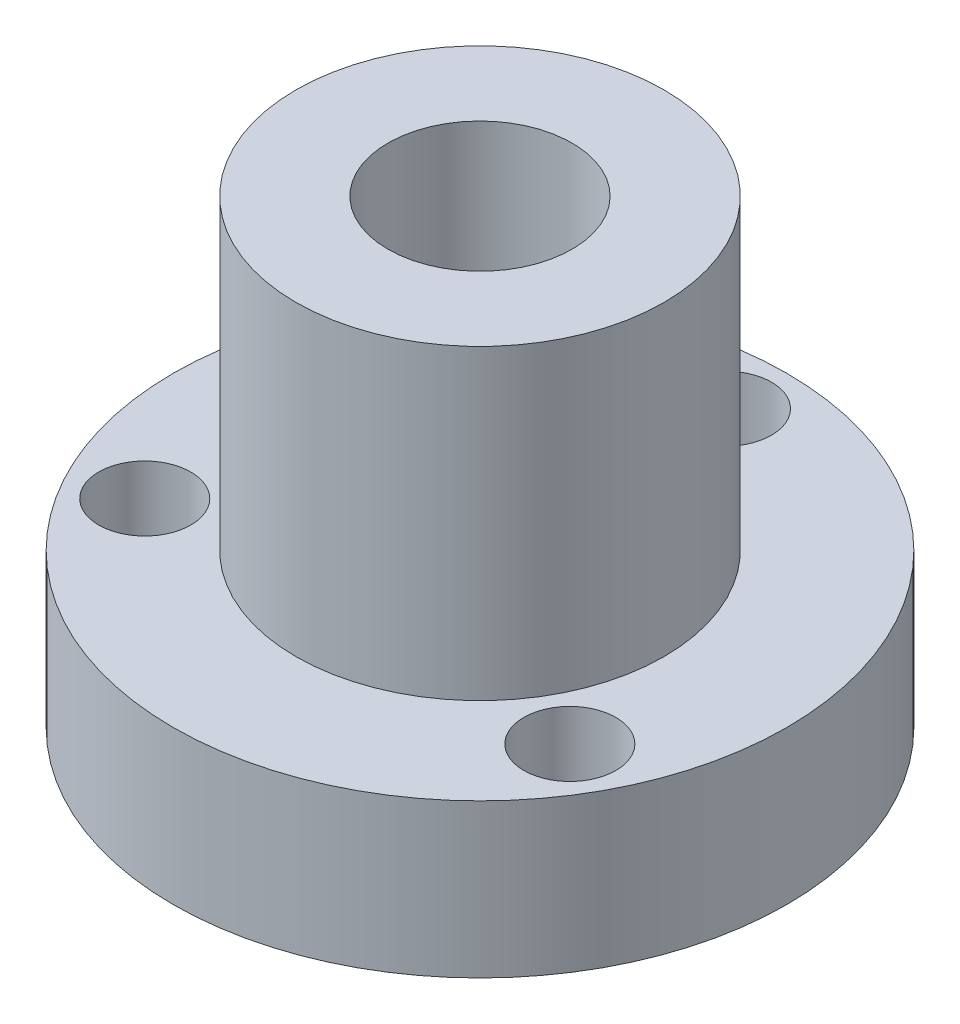
from build123d import *

# Parameters (mm, degrees)
SKETCH1_R           = 10
BOSS_EXTRUDE1_DEPTH = 5
SKETCH2_R           = 6
BOSS_EXTRUDE2_DEPTH = 10
SKETCH3_R           = 3
CUT_EXTRUDE1_DEPTH  = 21.615528128
SKETCH4_R           = 1.5
CUT_EXTRUDE2_DEPTH  = 18.320508076


with BuildPart() as part:
    # Sketch1 → Boss-Extrude1 (new body)
    with BuildSketch(Plane(origin=(0, 0, 0), x_dir=(1, 0, 0), z_dir=(0, 1, 0))):
        with Locations(Location((0, 0, 0), (0, 0, 270))):
            Circle(SKETCH1_R)
    extrude(amount=BOSS_EXTRUDE1_DEPTH)

    # Sketch2 → Boss-Extrude2 (add)
    with BuildSketch(Plane(origin=(0, 5, 0), x_dir=(1, 0, 0), z_dir=(0, 1, 0))):
        with Locations(Location((0, 0, 0), (0, 0, 270))):
            Circle(SKETCH2_R)
    extrude(amount=BOSS_EXTRUDE2_DEPTH)

    # Sketch3 → Cut-Extrude1 (cut, through all)
    with BuildSketch(Plane(origin=(0, 15, 0), x_dir=(1, 0, 0), z_dir=(0, 1, 0))):
        with Locations(Location((0, 0, 0), (0, 0, 270))):
            Circle(SKETCH3_R)
    extrude(amount=-CUT_EXTRUDE1_DEPTH, mode=Mode.SUBTRACT)

    # Sketch4 → Cut-Extrude2 (cut, through all)
    with BuildSketch(Plane(origin=(0, 5, 0), x_dir=(1, 0, 0), z_dir=(0, 1, 0))):
        with Locations(Location((0, 8, 0), (0, 0, 270))):
            Circle(SKETCH4_R)
        with Locations(Location((6.92820323, -4, 0), (0, 0, 270))):
            Circle(SKETCH4_R)
        with Locations(Location((-6.92820323, -4, 0), (0, 0, 270))):
            Circle(SKETCH4_R)
    extrude(amount=-CUT_EXTRUDE2_DEPTH, mode=Mode.SUBTRACT)


solid = part.part
